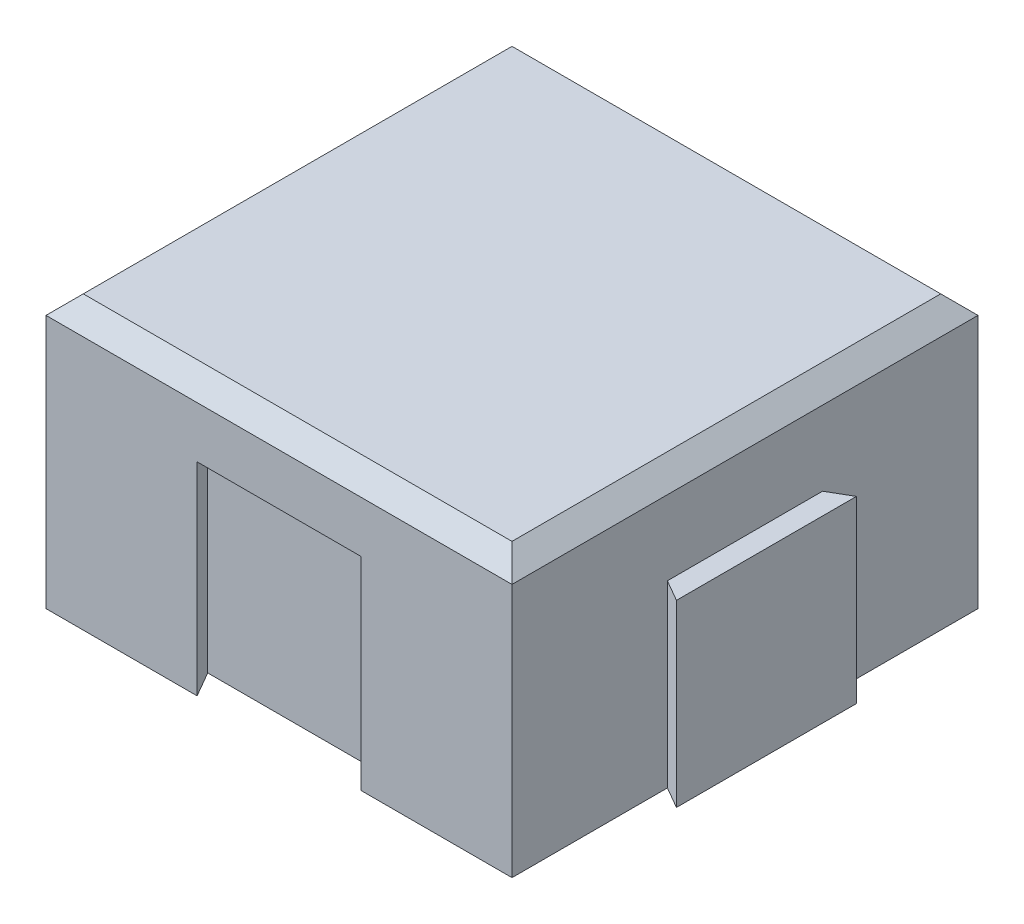
from build123d import *

# Parameters (mm, degrees)
SKETCH1_W           = 50
SKETCH1_H           = 50
BOSS_EXTRUDE1_DEPTH = 30
BOSS_EXTRUDE2_DEPTH = 20
BOSS_EXTRUDE3_DEPTH = 20
CUT_EXTRUDE5_DEPTH  = 20
CUT_EXTRUDE6_DEPTH  = 20
CHAMFER1_SIZE       = 2
SKETCH4_R           = 3.1
CUT_EXTRUDE4_DEPTH  = 4
CHAMFER2_SIZE       = 1
CHAMFER3_SIZE       = 0.75
CHAMFER4_SIZE       = 2.5


with BuildPart() as part:
    # Sketch1 → Boss-Extrude1 (new body)
    with BuildSketch(Plane(origin=(0, 0, 0), x_dir=(1, 0, 0), z_dir=(0, 1, 0))):
        with Locations((25, 25)):
            Rectangle(SKETCH1_W, SKETCH1_H)
    extrude(amount=BOSS_EXTRUDE1_DEPTH)

    # Sketch3 → Boss-Extrude2 (add)
    with BuildSketch(Plane(origin=(0, 0, 0), x_dir=(1, 0, 0), z_dir=(0, 1, 0))):
        Polygon((50, 16.674315781), (50, 33.325684219), (52.3, 34.653589838), (52.3, 15.346410162), align=None)
    extrude(amount=BOSS_EXTRUDE2_DEPTH)

    # Sketch3<3> → Boss-Extrude3 (add)
    with BuildSketch(Plane(origin=(0, 0, 0), x_dir=(1, 0, 0), z_dir=(0, 1, 0))):
        Polygon((33.325684219, 50), (16.674315781, 50), (15.346410162, 52.3), (34.653589838, 52.3), align=None)
    extrude(amount=BOSS_EXTRUDE3_DEPTH)

    # Sketch3<6> → Cut-Extrude5 (cut)
    with BuildSketch(Plane(origin=(0, 0, 0), x_dir=(1, 0, 0), z_dir=(0, 1, 0))):
        Polygon((0, 33.787564435), (2.7, 35.346410162), (2.7, 14.653589838), (0, 16.212435565), align=None)
    extrude(amount=CUT_EXTRUDE5_DEPTH, mode=Mode.SUBTRACT)

    # Sketch3<7> → Cut-Extrude6 (cut)
    with BuildSketch(Plane(origin=(0, 0, 0), x_dir=(1, 0, 0), z_dir=(0, 1, 0))):
        Polygon((16.212435565, 0), (14.653589838, 2.7), (35.346410162, 2.7), (33.787564435, 0), align=None)
    extrude(amount=CUT_EXTRUDE6_DEPTH, mode=Mode.SUBTRACT)

    # Chamfer1
    chamfer1_edges = [part.edges().sort_by_distance(p)[0] for p in [
        (25, 30, -50),
        (50, 30, -25),
        (25, 30, 0),
        (0, 30, -25),
    ]]
    chamfer(chamfer1_edges, length=CHAMFER1_SIZE)

    # Sketch4 → Cut-Extrude4 (cut)
    with BuildSketch(Plane(origin=(0, 0, 0), x_dir=(1, 0, 0), z_dir=(0, 1, 0))):
        with Locations((12.5, 37.5)):
            Circle(SKETCH4_R)
        with Locations((37.5, 37.5)):
            Circle(SKETCH4_R)
        with Locations((37.5, 12.5)):
            Circle(SKETCH4_R)
        with Locations((12.5, 12.5)):
            Circle(SKETCH4_R)
    extrude(amount=CUT_EXTRUDE4_DEPTH, mode=Mode.SUBTRACT)

    # Chamfer2
    chamfer2_edges = [part.edges().sort_by_distance(p)[0] for p in [
        (34.4, 4, -12.5),
        (9.4, 4, -12.5),
        (9.4, 4, -37.5),
        (34.4, 4, -37.5),
    ]]
    chamfer(chamfer2_edges, length=CHAMFER2_SIZE)

    # Chamfer3
    chamfer3_edges = [part.edges().sort_by_distance(p)[0] for p in [
        (41.893782217, 0, 0),
        (50, 0, -8.33715789),
        (50, 0, -41.66284211),
        (41.66284211, 0, -50),
        (8.33715789, 0, -50),
        (0, 0, -41.893782217),
        (0, 0, -8.106217783),
        (8.106217783, 0, 0),
        (9.4, 0, -37.5),
        (34.4, 0, -37.5),
        (34.4, 0, -12.5),
        (9.4, 0, -12.5),
        (51.15, 0, -16.010362971),
        (52.3, 0, -25),
        (51.15, 0, -33.989637029),
        (33.989637029, 0, -51.15),
        (25, 0, -52.3),
        (16.010362971, 0, -51.15),
        (1.35, 0, -34.566987298),
        (2.7, 0, -25),
        (1.35, 0, -15.433012702),
        (15.433012702, 0, -1.35),
        (25, 0, -2.7),
        (34.566987298, 0, -1.35),
    ]]
    chamfer(chamfer3_edges, length=CHAMFER3_SIZE)

    # Chamfer4
    chamfer4_edges = [part.edges().sort_by_distance(p)[0] for p in [
        (25, 20, 0),
        (0, 20, -25),
    ]]
    chamfer(chamfer4_edges, length=CHAMFER4_SIZE)


solid = part.part
